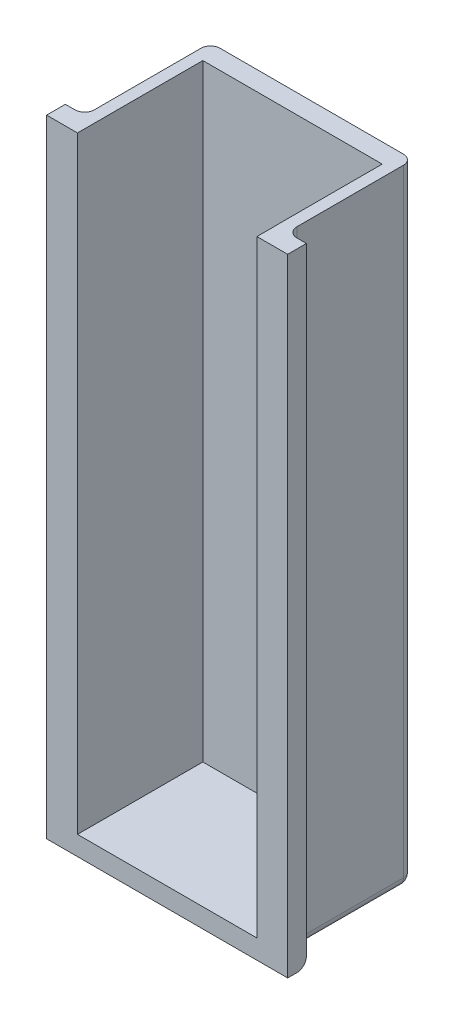
from build123d import *

# Parameters (mm, degrees)
ESQUISSE1_W                  = 25
ESQUISSE1_H                  = 65
BOSS_EXTRU_1_DEPTH           = 15
ENL_V_MAT_EXTRU_1_DEPTH      = 68.869359802
ENL_V_MAT_EXTRU_1_DEPTH_BACK = 68.869359802
ESQUISSE2_W                  = 1.99730465
ESQUISSE2_H                  = 13.055396478
ESQUISSE3_W                  = 18.6
ESQUISSE3_H                  = 10.964826829
ENL_V_MAT_EXTRU_2_DEPTH      = 63
ESQUISSE4_W                  = 18.610580781
ESQUISSE4_H                  = 2.037454763
ENL_V_MAT_EXTRU_3_DEPTH      = 63
CONG_1_R                     = 1


with BuildPart() as part:
    # Esquisse1 → Boss.-Extru.1 (new body)
    with BuildSketch(Plane.XY):
        Rectangle(ESQUISSE1_W, ESQUISSE1_H)
    extrude(amount=BOSS_EXTRU_1_DEPTH)

    # Esquisse2 → Enlèv. mat.-Extru.1 (cut, two sides: drawn at the far end of the back side and taken through both)
    with BuildSketch(Plane(origin=(0, 32.5, 0), x_dir=(1, 0, 0), z_dir=(0, 1, 0)).offset(-ENL_V_MAT_EXTRU_1_DEPTH_BACK)):
        with Locations((11.501347675, -6.527698239)):
            Rectangle(ESQUISSE2_W, ESQUISSE2_H)
        with Locations((-11.501347675, -6.527698239)):
            Rectangle(ESQUISSE2_W, ESQUISSE2_H)
    extrude(amount=ENL_V_MAT_EXTRU_1_DEPTH + ENL_V_MAT_EXTRU_1_DEPTH_BACK, mode=Mode.SUBTRACT)

    # Esquisse3 → Enlèv. mat.-Extru.2 (cut)
    with BuildSketch(Plane(origin=(0, 32.5, 0), x_dir=(1, 0, 0), z_dir=(0, 1, 0))):
        with Locations((0, -7.480131823)):
            Rectangle(ESQUISSE3_W, ESQUISSE3_H)
    extrude(amount=-ENL_V_MAT_EXTRU_2_DEPTH, mode=Mode.SUBTRACT)

    # Esquisse4 → Enlèv. mat.-Extru.3 (cut)
    with BuildSketch(Plane(origin=(0, 32.5, 0), x_dir=(1, 0, 0), z_dir=(0, 1, 0))):
        with Locations((0.00529039, -13.981272619)):
            Rectangle(ESQUISSE4_W, ESQUISSE4_H)
    extrude(amount=-ENL_V_MAT_EXTRU_3_DEPTH, mode=Mode.SUBTRACT)

    # Congé1
    cong_1_edges = [part.edges().sort_by_distance(p)[0] for p in [
        (0, -32.5, 0),
        (-10.50269535, 0, 13.055396478),
        (-11.501347675, -32.5, 13.055396478),
        (-10.50269535, 0, 0),
        (-10.50269535, -32.5, 6.527698239),
        (10.50269535, 0, 0),
        (11.501347675, -32.5, 13.055396478),
        (10.50269535, 0, 13.055396478),
        (10.50269535, -32.5, 6.527698239),
    ]]
    fillet(cong_1_edges, radius=CONG_1_R)


solid = part.part
